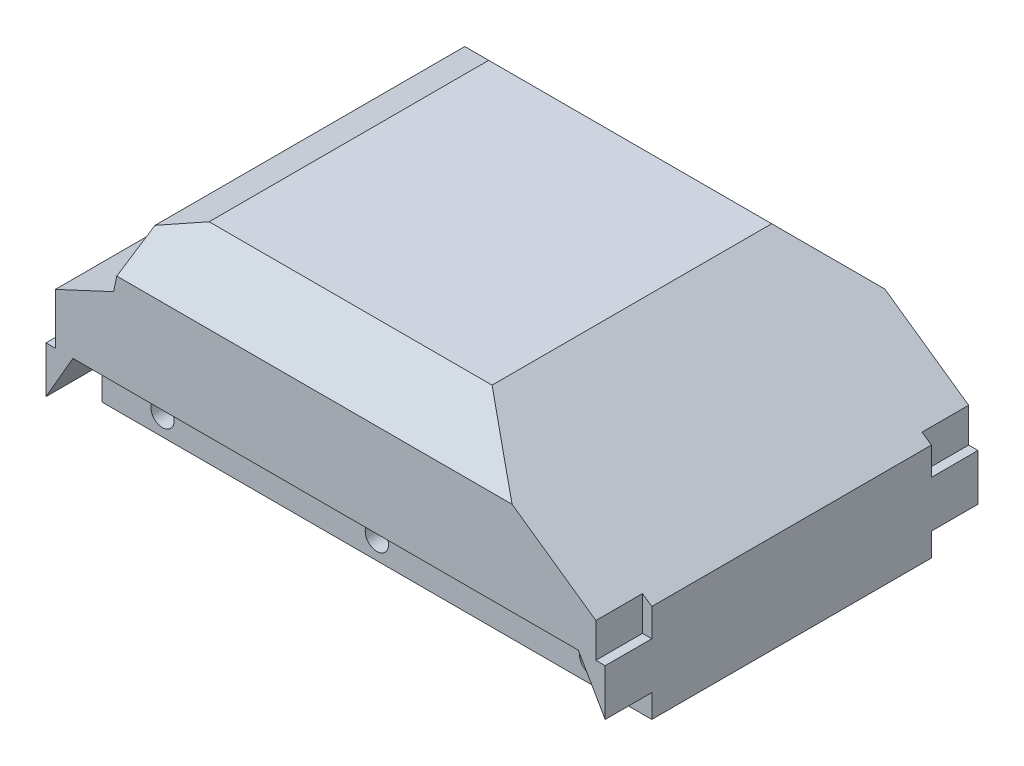
from build123d import *

# Parameters (mm, degrees)
BOSS_EXTRUDE1_DEPTH             = 38.1
CUT_EXTRUDE1_DEPTH              = 100.190170884
CUT_EXTRUDE1_DEPTH_BACK         = 100.190170884
BOSS_EXTRUDE2_REACH             = 101.19
BOSS_EXTRUDE2_DIRECTION_2_REACH = 101.19
CUT_EXTRUDE2_DEPTH              = 100.190170884
CUT_EXTRUDE2_DEPTH_BACK         = 100.190170884
SKETCH5_W                       = 149.86
SKETCH5_H                       = 76.2
BOSS_EXTRUDE4_DEPTH             = 19.05
SKETCH6_R                       = 3.175
CUT_EXTRUDE3_DEPTH              = 188.543158451


with BuildPart() as part:
    # Sketch1 → Boss-Extrude1 (new body)
    with BuildSketch(Plane(origin=(44.224720049, 74.891650501, 130.282900288), x_dir=(1, 0, 0), z_dir=(0, 1, 0))):
        Polygon((-73.66, -50.8), (-73.66, -19.05), (-76.2, -19.05), (-76.2, 19.05), (-73.66, 19.05), (-73.66, 50.8), (73.66, 50.8), (73.66, 38.1), (76.2, 38.1), (76.2, -38.1), (73.66, -38.1), (73.66, -50.8), align=None)
    extrude(amount=BOSS_EXTRUDE1_DEPTH)

    # Sketch2 → Cut-Extrude1 (cut, two sides: drawn at the far end of the back side and taken through both)
    with BuildSketch(Plane(origin=(44.224720049, 74.891650501, 130.282900288), x_dir=(1, 0, 0), z_dir=(0, 0, 1)).offset(-CUT_EXTRUDE1_DEPTH_BACK)):
        Polygon((-76.2, 12.7), (-57.783825767, 21.287603079), (-55.084357434, 33.987603079), (-44.45, 38.1), (-76.2, 38.1), align=None)
        Polygon((32.670048754, 38.1), (76.2, 7.62), (76.2, 38.1), align=None)
    extrude(amount=CUT_EXTRUDE1_DEPTH + CUT_EXTRUDE1_DEPTH_BACK, mode=Mode.SUBTRACT)

    # Boss-Extrude2: up to this face of the body (flat: up to its plane)
    boss_extrude2_end = Plane(part.part.faces().sort_by_distance((41.857775963, 91.970339861, 181.082900288))[0])
    # Sketch3 → Boss-Extrude2 (add, up to the picked face)
    with BuildSketch(Plane(origin=(44.224720049, 74.891650501, 130.282900288), x_dir=(1, 0, 0), z_dir=(0, 0, 1)), mode=Mode.PRIVATE) as boss_extrude2_sk1:
        Polygon((-76.2, 0), (-76.2, -12.7), (-68.867651581, 0), align=None)
    boss_extrude2_tool1 = split(extrude(boss_extrude2_sk1.sketch, amount=BOSS_EXTRUDE2_REACH, mode=Mode.PRIVATE), bisect_by=boss_extrude2_end, keep=Keep.BOTH, mode=Mode.PRIVATE)
    # Sketch3 → Boss-Extrude2 (add, up to the picked face)
    with BuildSketch(Plane(origin=(44.224720049, 74.891650501, 130.282900288), x_dir=(1, 0, 0), z_dir=(0, 0, 1)), mode=Mode.PRIVATE) as boss_extrude2_sk2:
        Polygon((76.2, 0), (76.2, -12.7), (68.867651581, 0), align=None)
    boss_extrude2_tool2 = split(extrude(boss_extrude2_sk2.sketch, amount=BOSS_EXTRUDE2_REACH, mode=Mode.PRIVATE), bisect_by=boss_extrude2_end, keep=Keep.BOTH, mode=Mode.PRIVATE)
    add(boss_extrude2_tool1.solids().sort_by(Axis((-29.531164, 70.658317, 130.2829), (0, 0, 1)))[0])
    add(boss_extrude2_tool2.solids().sort_by(Axis((117.980604, 70.658317, 130.2829), (0, 0, 1)))[0])

    # Boss-Extrude2 direction 2: up to this face of the body (flat: up to its plane)
    boss_extrude2_direction_2_end = Plane(part.part.faces().sort_by_distance((41.857775963, 91.970339861, 79.482900288))[0])
    # Sketch3 → Boss-Extrude2 direction 2 (add, up to the picked face)
    with BuildSketch(Plane(origin=(44.224720049, 74.891650501, 130.282900288), x_dir=(1, 0, 0), z_dir=(0, 0, 1)), mode=Mode.PRIVATE) as boss_extrude2_direction_2_sk1:
        Polygon((-76.2, 0), (-76.2, -12.7), (-68.867651581, 0), align=None)
    boss_extrude2_direction_2_tool1 = split(extrude(boss_extrude2_direction_2_sk1.sketch, amount=-BOSS_EXTRUDE2_DIRECTION_2_REACH, mode=Mode.PRIVATE), bisect_by=boss_extrude2_direction_2_end, keep=Keep.BOTH, mode=Mode.PRIVATE)
    # Sketch3 → Boss-Extrude2 direction 2 (add, up to the picked face)
    with BuildSketch(Plane(origin=(44.224720049, 74.891650501, 130.282900288), x_dir=(1, 0, 0), z_dir=(0, 0, 1)), mode=Mode.PRIVATE) as boss_extrude2_direction_2_sk2:
        Polygon((76.2, 0), (76.2, -12.7), (68.867651581, 0), align=None)
    boss_extrude2_direction_2_tool2 = split(extrude(boss_extrude2_direction_2_sk2.sketch, amount=-BOSS_EXTRUDE2_DIRECTION_2_REACH, mode=Mode.PRIVATE), bisect_by=boss_extrude2_direction_2_end, keep=Keep.BOTH, mode=Mode.PRIVATE)
    add(boss_extrude2_direction_2_tool1.solids().sort_by(Axis((-29.531164, 70.658317, 130.2829), (0, 0, -1)))[0])
    add(boss_extrude2_direction_2_tool2.solids().sort_by(Axis((117.980604, 70.658317, 130.2829), (0, 0, -1)))[0])

    # Sketch4 → Cut-Extrude2 (cut, two sides: drawn at the far end of the back side and taken through both)
    with BuildSketch(Plane(origin=(44.224720049, 74.891650501, 130.282900288), x_dir=(0, 0, -1), z_dir=(1, 0, 0)).offset(-CUT_EXTRUDE2_DEPTH_BACK)):
        Polygon((-38.1, 38.1), (-50.8, 25.4), (-50.8, 38.1), align=None)
        Polygon((38.1, 38.1), (50.8, 25.4), (50.8, 38.1), align=None)
    extrude(amount=CUT_EXTRUDE2_DEPTH + CUT_EXTRUDE2_DEPTH_BACK, mode=Mode.SUBTRACT)

    # Sketch5 → Boss-Extrude4 (add)
    with BuildSketch(Plane.XZ.offset(-74.891650501)):
        with Locations((45.494720049, 130.282900288)):
            Rectangle(SKETCH5_W, SKETCH5_H)
    extrude(amount=BOSS_EXTRUDE4_DEPTH)

    # Sketch6 → Cut-Extrude3 (cut, through all)
    with BuildSketch(Plane(origin=(0, 0, 92.182900288), x_dir=(-1, 0, 0), z_dir=(0, 0, -1))):
        with Locations((-103.914720049, 61.216355026)):
            Circle(SKETCH6_R)
        with Locations((-45.494720049, 61.216355026)):
            Circle(SKETCH6_R)
        with Locations((12.925279951, 61.216355026)):
            Circle(SKETCH6_R)
    extrude(amount=-CUT_EXTRUDE3_DEPTH, mode=Mode.SUBTRACT)


solid = part.part
